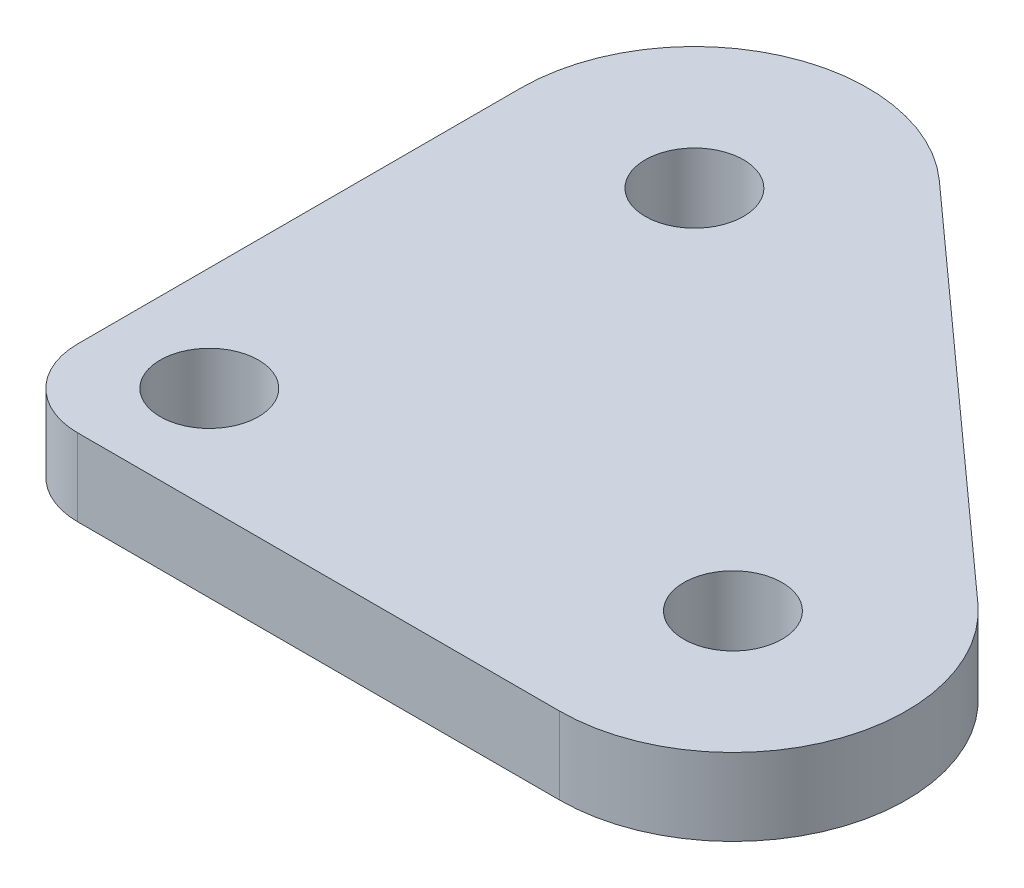
from build123d import *

# Parameters (mm, degrees)
SKETCH1_R           = 2.55
BOSS_EXTRUDE1_DEPTH = 4
FILLET1_R           = 4
CUT_EXTRUDE1_DEPTH  = 4


with BuildPart() as part:
    # Sketch1 → Boss-Extrude1 (new body)
    with BuildSketch(Plane(origin=(0, 0, 0), x_dir=(1, 0, 0), z_dir=(0, 1, 0))):
        with BuildLine():
            Line((-9, 18), (-9, -9))
            Line((-9, -9), (20, -9))
            ThreePointArc((20, -9), (28.402583705, -3.224373905), (26.020682585, 6.689647316))
            Line((26.020682585, 6.689647316), (6.020682585, 24.689647316))
            ThreePointArc((6.020682585, 24.689647316), (-3.661547264, 26.22150057), (-9, 18))
        make_face()
        with Locations(Location((20, 0, 0), (0, 0, 270))):
            Circle(SKETCH1_R, mode=Mode.SUBTRACT)
        with Locations(Location((0, 18, 0), (0, 0, 270))):
            Circle(SKETCH1_R, mode=Mode.SUBTRACT)
    extrude(amount=BOSS_EXTRUDE1_DEPTH)

    # Fillet1
    fillet1_edges = [part.edges().sort_by_distance(p)[0] for p in [
        (-9, 2, 9),
    ]]
    fillet(fillet1_edges, radius=FILLET1_R)

    # Sketch2 → Cut-Extrude1 (cut)
    with BuildSketch(Plane.XZ):
        with BuildLine():
            ThreePointArc((-1.035786438, 3.585786438), (-1.782664146, 5.38890873), (-3.585786438, 6.135786438))
            Line((-3.585786438, 6.135786438), (-3.585786438, 3.585786438))
            Line((-3.585786438, 3.585786438), (-6.135786438, 3.585786438))
            ThreePointArc((-6.135786438, 3.585786438), (-3.585786438, 1.035786438), (-1.035786438, 3.585786438))
        make_face()
        with BuildLine():
            Line((-3.585786438, 3.585786438), (-3.585786438, 6.135786438))
            ThreePointArc((-3.585786438, 6.135786438), (-5.38890873, 5.38890873), (-6.135786438, 3.585786438))
            Line((-6.135786438, 3.585786438), (-3.585786438, 3.585786438))
        make_face()
    extrude(amount=-CUT_EXTRUDE1_DEPTH, mode=Mode.SUBTRACT)


solid = part.part
